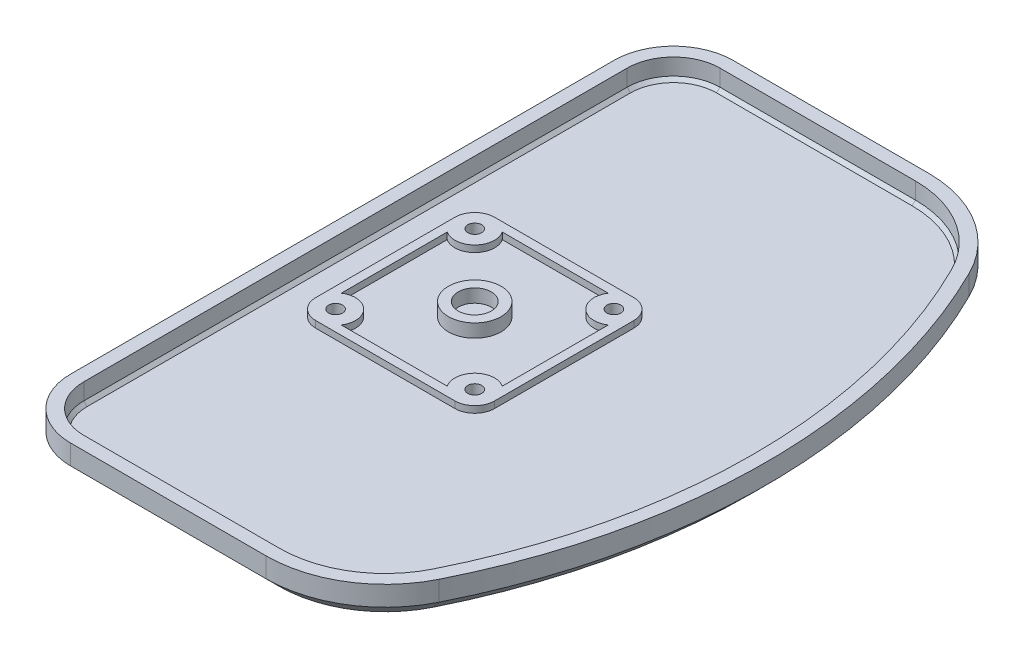
from build123d import *

# Parameters (mm, degrees)
EXTRUDE_1_DEPTH              = 5
FILLET_1_R                   = 9
FILLET_2_R                   = 18
SHELL_1_T                    = -2
CHAMFER_1_SIZE               = 0.5
CHAMFER_2_SIZE               = 2
SKETCH_2_W                   = 27
SKETCH_2_H                   = 27
EXTRUDE_2_DEPTH              = 1
SKETCH_3_R                   = 3.975
EXTRUDE_3_DEPTH              = 1
FILLET_3_R                   = 3
HOLE_WIZARD_M2_1_D           = 2.1
HOLE_WIZARD_M2_1_CBORE_D     = 3.8
HOLE_WIZARD_M2_1_CBORE_DEPTH = 1
PATTERN_CIRCULAR_1_COUNT     = 4
SKETCH_6_R                   = 3.975
CUT_EXTRUDE_1_DEPTH          = 1
SKETCH_7_R                   = 2.5
CUT_EXTRUDE_2_DEPTH          = 2


with BuildPart() as part:
    # ｽｹｯﾁ1 → ﾎﾞｽ - 押し出し1 (new body)
    with BuildSketch(Plane(origin=(0, 0, 0), x_dir=(1, 0, 0), z_dir=(0, 1, 0))):
        with BuildLine():
            Line((-20, 50), (28.833147735, 50))
            ThreePointArc((28.833147735, 50), (44, 0), (28.833147735, -50))
            Line((28.833147735, -50), (-20, -50))
            Line((-20, -50), (-20, 50))
        make_face()
    extrude(amount=EXTRUDE_1_DEPTH)

    # ﾌｨﾚｯﾄ1
    fillet_1_edges = [part.edges().sort_by_distance(p)[0] for p in [
        (-20, 2.5, -50),
        (-20, 2.5, 50),
    ]]
    fillet(fillet_1_edges, radius=FILLET_1_R)

    # ﾌｨﾚｯﾄ2
    fillet_2_edges = [part.edges().sort_by_distance(p)[0] for p in [
        (28.833147735, 2.5, -50),
        (28.833147735, 2.5, 50),
    ]]
    fillet(fillet_2_edges, radius=FILLET_2_R)

    # ｼｪﾙ1
    shell_1_openings = [part.faces().sort_by_distance(p)[0] for p in [
        (9.782139289, 5, 0),
    ]]
    offset(amount=SHELL_1_T, openings=shell_1_openings, kind=Kind.INTERSECTION)

    # 面取り1
    chamfer_1_edges = [part.edges().sort_by_distance(p)[0] for p in [
        (-18, 2, 0),
        (3.749030993, 2, 48),
        (42, 2, 0),
        (3.749030993, 2, -48),
        (26.930802414, 2, -45.59738537),
        (26.930802414, 2, 45.59738537),
        (-15.949747468, 2, 45.949747468),
        (-15.949747468, 2, -45.949747468),
    ]]
    chamfer(chamfer_1_edges, length=CHAMFER_1_SIZE)

    # 面取り2
    chamfer_2_edges = [part.edges().sort_by_distance(p)[0] for p in [
        (-20, 0, 0),
        (3.749030993, 0, 50),
        (-17.363961031, 0, 47.363961031),
        (-17.363961031, 0, -47.363961031),
        (3.749030993, 0, -50),
        (44, 0, 0),
        (27.984894967, 0, 47.297058541),
        (27.984894967, 0, -47.297058541),
    ]]
    chamfer(chamfer_2_edges, length=CHAMFER_2_SIZE)

    # ｽｹｯﾁ2 → ﾎﾞｽ - 押し出し2 (add)
    with BuildSketch(Plane(origin=(0, 2, 0), x_dir=(1, 0, 0), z_dir=(0, 1, 0))):
        Rectangle(SKETCH_2_W, SKETCH_2_H)
    extrude(amount=EXTRUDE_2_DEPTH)

    # ｽｹｯﾁ3 → ﾎﾞｽ - 押し出し3 (add)
    with BuildSketch(Plane(origin=(0, 3, 0), x_dir=(1, 0, 0), z_dir=(0, 1, 0))):
        with Locations(Location((0, 0, 0), (0, 0, 270))):
            Circle(SKETCH_3_R)
    extrude(amount=EXTRUDE_3_DEPTH)

    # ﾌｨﾚｯﾄ3
    fillet_3_edges = [part.edges().sort_by_distance(p)[0] for p in [
        (13.5, 2.5, 13.5),
        (13.5, 2.5, -13.5),
        (-13.5, 2.5, -13.5),
        (-13.5, 2.5, 13.5),
    ]]
    fillet(fillet_3_edges, radius=FILLET_3_R)

    # M2 なべ頭ねじ用座ぐり穴1 (through all)
    with Locations(Plane(origin=(0, 0, 0), x_dir=(-1, 0, 0), z_dir=(0, -1, 0))):
        with Locations((10.5, 10.5)):
            hole_wizard_m2_1 = CounterBoreHole(HOLE_WIZARD_M2_1_D / 2, HOLE_WIZARD_M2_1_CBORE_D / 2, HOLE_WIZARD_M2_1_CBORE_DEPTH)

    # 円形ﾊﾟﾀｰﾝ1: M2 なべ頭ねじ用座ぐり穴1 ×4 about axis
    pattern_circular_1_axis = Axis((0, 0, 0), (0, 1, 0))
    for i in range(1, PATTERN_CIRCULAR_1_COUNT):
        add(hole_wizard_m2_1.rotate(pattern_circular_1_axis, i * 360 / PATTERN_CIRCULAR_1_COUNT), mode=Mode.SUBTRACT)

    # ｽｹｯﾁ6 → ｶｯﾄ - 押し出し1 (cut)
    with BuildSketch(Plane(origin=(0, 3, 0), x_dir=(1, 0, 0), z_dir=(0, 1, 0))):
        with BuildLine():
            Line((-7.994506037, -12.15), (7.994506037, -12.15))
            ThreePointArc((7.994506037, -12.15), (8.378679656, -8.378679656), (12.15, -7.994506037))
            Line((12.15, -7.994506037), (12.15, 7.994506037))
            ThreePointArc((12.15, 7.994506037), (8.378679656, 8.378679656), (7.994506037, 12.15))
            Line((7.994506037, 12.15), (-7.994506037, 12.15))
            ThreePointArc((-7.994506037, 12.15), (-7.62628447, 11.36125435), (-7.5, 10.5))
            ThreePointArc((-7.5, 10.5), (-9.076975053, 7.858977471), (-12.15, 7.994506037))
            Line((-12.15, 7.994506037), (-12.15, -7.994506037))
            ThreePointArc((-12.15, -7.994506037), (-9.076975053, -7.858977471), (-7.5, -10.5))
            ThreePointArc((-7.5, -10.5), (-7.62628447, -11.36125435), (-7.994506037, -12.15))
        make_face()
        with Locations(Location((0, 0, 0), (0, 0, 270))):
            Circle(SKETCH_6_R, mode=Mode.SUBTRACT)
    extrude(amount=-CUT_EXTRUDE_1_DEPTH, mode=Mode.SUBTRACT)

    # ｽｹｯﾁ7 → ｶｯﾄ - 押し出し2 (cut)
    with BuildSketch(Plane(origin=(0, 4, 0), x_dir=(1, 0, 0), z_dir=(0, 1, 0))):
        with Locations(Location((0, 0, 0), (0, 0, 270))):
            Circle(SKETCH_7_R)
    extrude(amount=-CUT_EXTRUDE_2_DEPTH, mode=Mode.SUBTRACT)


solid = part.part
